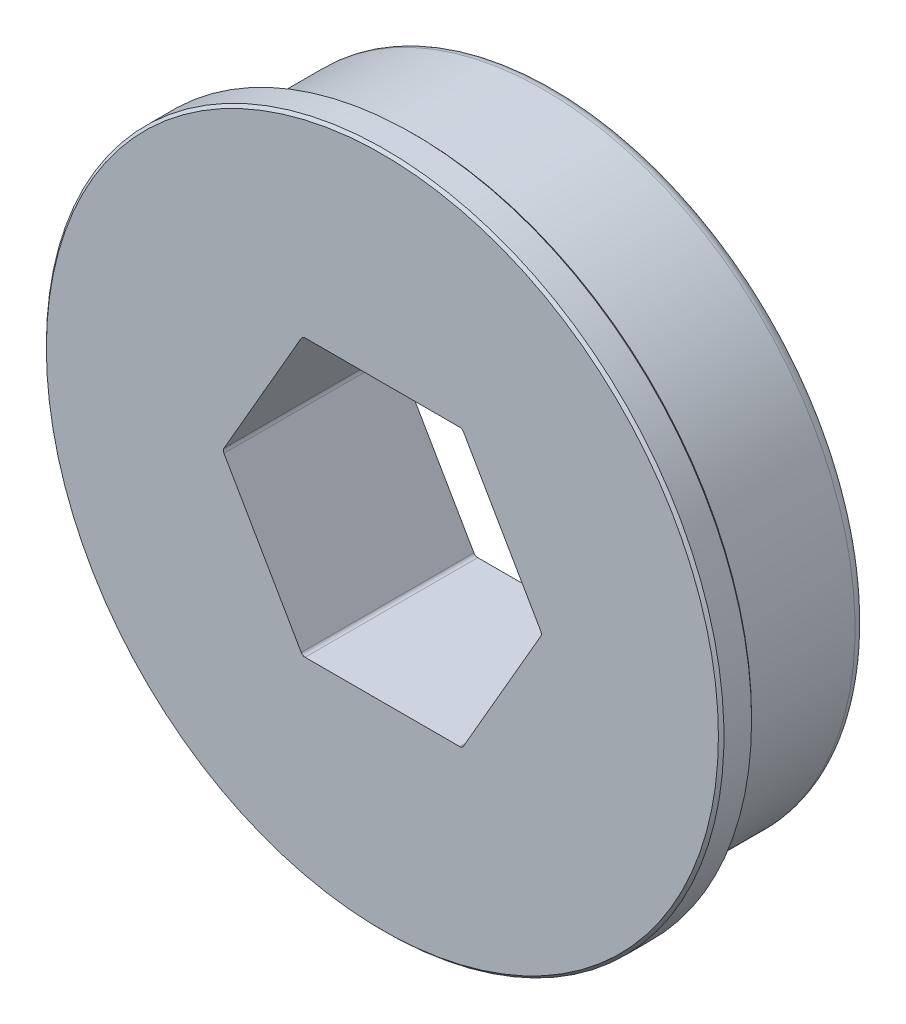
from build123d import *

# Parameters (mm, degrees)
SKETCH1_R           = 15.5575
BOSS_EXTRUDE1_DEPTH = 1.524
SKETCH2_R           = 13.97
BOSS_EXTRUDE2_DEPTH = 0.508
SKETCH3_R           = 14.2875
BOSS_EXTRUDE3_DEPTH = 5.89534
CUT_EXTRUDE1_DEPTH  = 24.386199605
CHAMFER1_SIZE       = 0.127
CHAMFER2_SIZE       = 0.127
FILLET1_R           = 0.2032
FILLET2_R           = 0.508


with BuildPart() as part:
    # Sketch1 → Boss-Extrude1 (new body)
    with BuildSketch(Plane(origin=(0, 0, 6.40334), x_dir=(-1, 0, 0), z_dir=(0, 0, -1))):
        Circle(SKETCH1_R)
    extrude(amount=-BOSS_EXTRUDE1_DEPTH)

    # Sketch2 → Boss-Extrude2 (add)
    with BuildSketch(Plane(origin=(0, 0, 6.40334), x_dir=(-1, 0, 0), z_dir=(0, 0, -1))):
        Circle(SKETCH2_R)
    extrude(amount=BOSS_EXTRUDE2_DEPTH)

    # Sketch3 → Boss-Extrude3 (add)
    with BuildSketch(Plane.XY.offset(5.89534)):
        with Locations(Location((0, 0, 0), (0, 0, 180))):
            Circle(SKETCH3_R)
    extrude(amount=-BOSS_EXTRUDE3_DEPTH)

    # Sketch4 → Cut-Extrude1 (cut, through all)
    with BuildSketch(Plane.XY.offset(7.92734)):
        Polygon((7.332348419, 0), (3.666174209, 6.35), (-3.666174209, 6.35), (-7.332348419, 0), (-3.666174209, -6.35), (3.666174209, -6.35), align=None)
    extrude(amount=-CUT_EXTRUDE1_DEPTH, mode=Mode.SUBTRACT)

    # Chamfer1
    chamfer1_edges = [part.edges().sort_by_distance(p)[0] for p in [
        (15.5575, 0, 7.92734),
    ]]
    chamfer(chamfer1_edges, length=CHAMFER1_SIZE)

    # Chamfer2
    chamfer2_edges = [part.edges().sort_by_distance(p)[0] for p in [
        (15.5575, 0, 6.40334),
    ]]
    chamfer(chamfer2_edges, length=CHAMFER2_SIZE)

    # Fillet1
    fillet1_edges = [part.edges().sort_by_distance(p)[0] for p in [
        (7.332348419, 0, 3.96367),
        (3.666174209, -6.35, 3.96367),
        (-3.666174209, -6.35, 3.96367),
        (-7.332348419, 0, 3.96367),
        (-3.666174209, 6.35, 3.96367),
        (3.666174209, 6.35, 3.96367),
    ]]
    fillet(fillet1_edges, radius=FILLET1_R)

    # Fillet2
    fillet2_edges = [part.edges().sort_by_distance(p)[0] for p in [
        (14.2875, 0, 0),
    ]]
    fillet(fillet2_edges, radius=FILLET2_R)


solid = part.part
